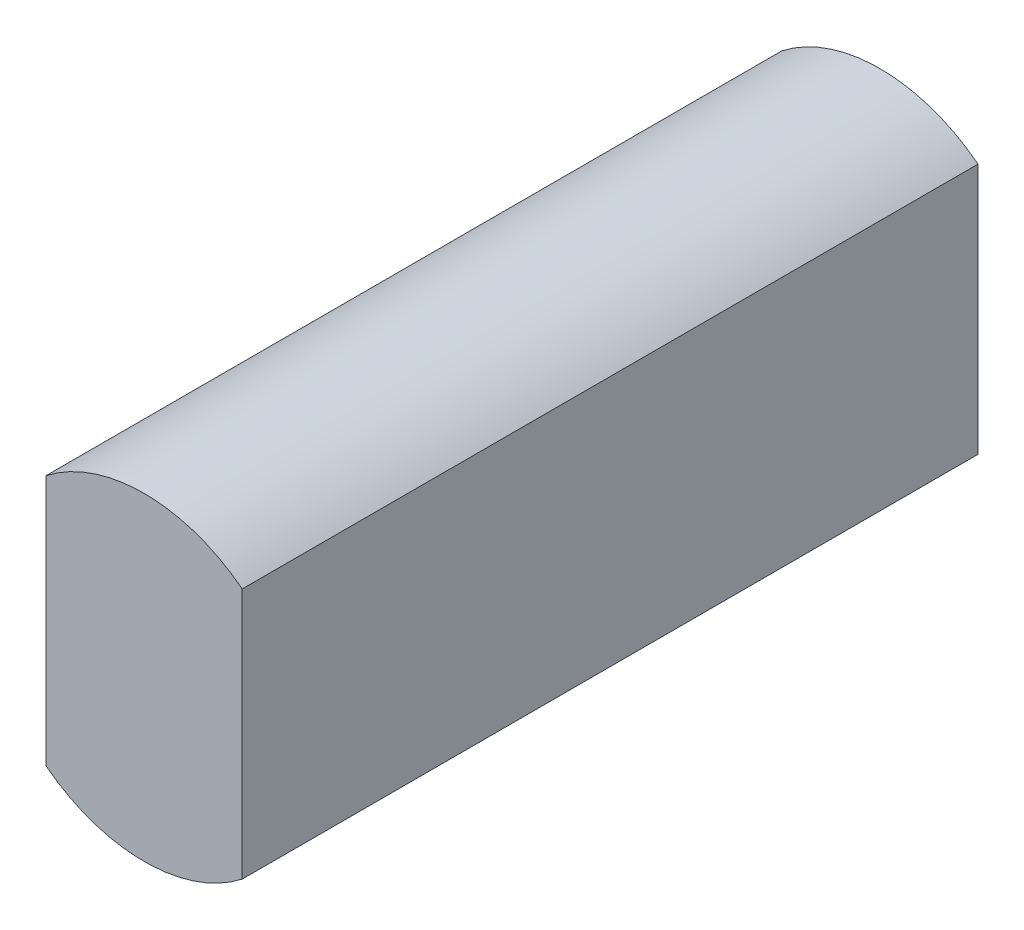
from build123d import *

# Parameters (mm, degrees)
BOSS_EXTRUDE1_DEPTH      = 20
BOSS_EXTRUDE1_DEPTH_BACK = 40


with BuildPart() as part:
    # Sketch1 → Boss-Extrude1 (new, two sides: drawn at the far end of the back side and taken through both)
    with BuildSketch(Plane.XY.offset(-BOSS_EXTRUDE1_DEPTH_BACK)):
        with BuildLine():
            Line((8, 10.246950766), (8, -10.246950766))
            ThreePointArc((8, -10.246950766), (0, -13), (-8, -10.246950766))
            Line((-8, -10.246950766), (-8, 10.246950766))
            ThreePointArc((-8, 10.246950766), (0, 13), (8, 10.246950766))
        make_face()
    extrude(amount=BOSS_EXTRUDE1_DEPTH + BOSS_EXTRUDE1_DEPTH_BACK)


solid = part.part
